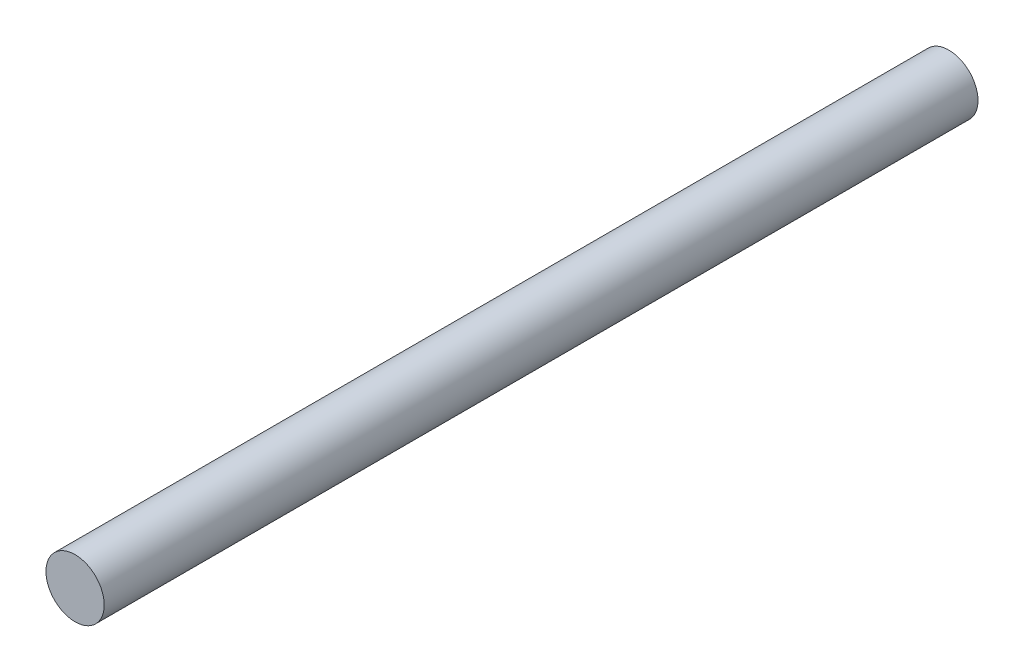
from build123d import *

# Parameters (mm, degrees)
SKETCH_1_R      = 0.5
EXTRUDE_1_DEPTH = 15


with BuildPart() as part:
    # 草图1 → 凸台-拉伸1 (new body)
    with BuildSketch(Plane.XY):
        Circle(SKETCH_1_R)
    extrude(amount=EXTRUDE_1_DEPTH)


solid = part.part
